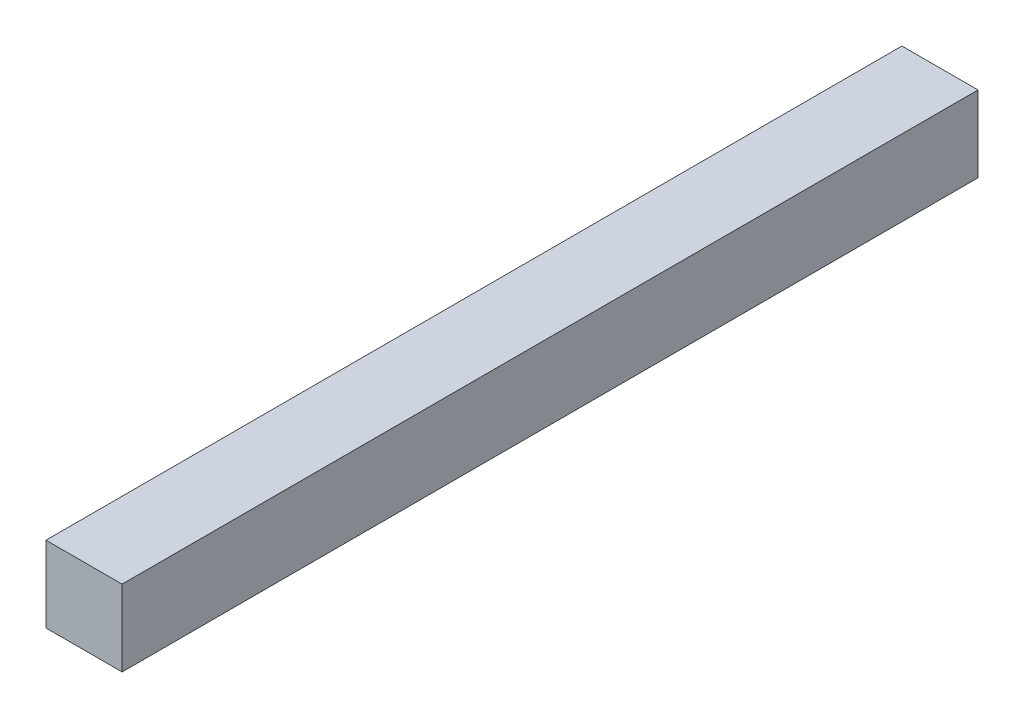
from build123d import *

# Parameters (mm, degrees)
SKETCH1_W           = 88.9
SKETCH1_H           = 88.9
BOSS_EXTRUDE1_DEPTH = 1000


with BuildPart() as part:
    # Sketch1 → Boss-Extrude1 (new body)
    with BuildSketch(Plane.XY):
        with Locations((44.45, 44.45)):
            Rectangle(SKETCH1_W, SKETCH1_H)
    extrude(amount=BOSS_EXTRUDE1_DEPTH)


solid = part.part
